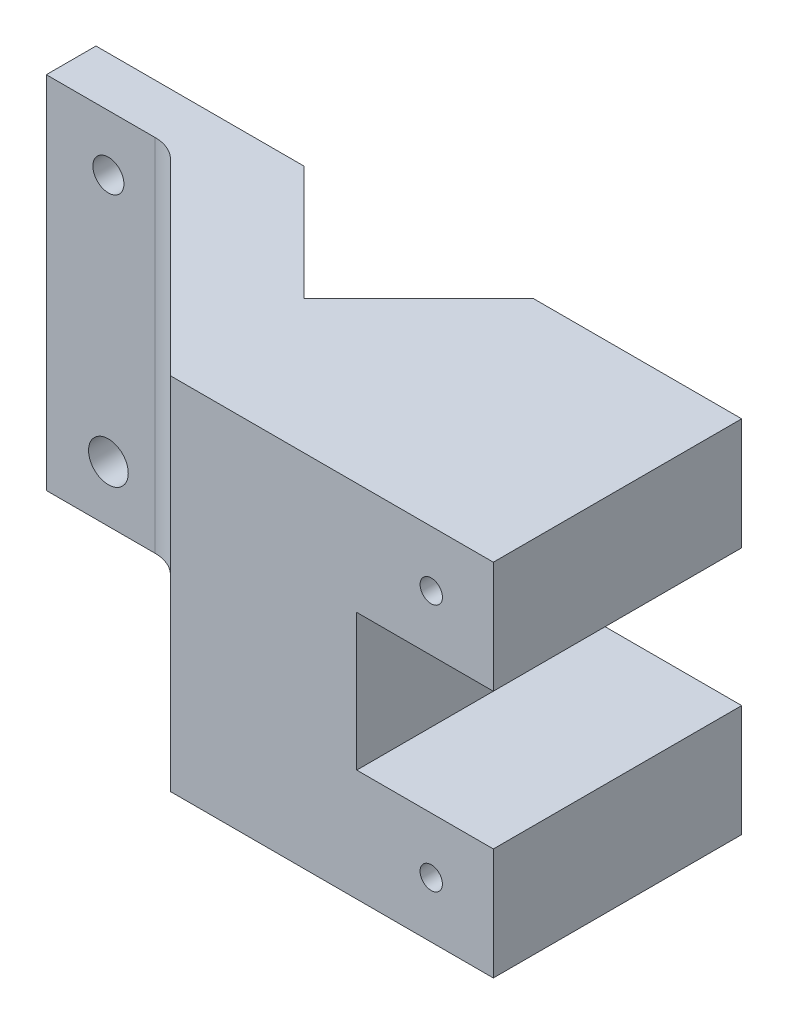
from build123d import *

# Parameters (mm, degrees)
BOSS_EXTRUDE1_DEPTH     = 14.5
CUT_EXTRUDE2_DEPTH      = 36.864327681
CUT_EXTRUDE2_DEPTH_BACK = 36.864327681
SKETCH4_R               = 0.9
SKETCH4_W               = 11
SKETCH4_H               = 11
SKETCH5_R               = 1.25
SKETCH5_R_2             = 1.6
CUT_EXTRUDE3_DEPTH      = 34.797189232
FILLET1_R               = 3
CUT_EXTRUDE5_DEPTH      = 36.864327681
CUT_EXTRUDE5_DEPTH_BACK = 36.864327681


with BuildPart() as part:
    # Sketch1 → Boss-Extrude1 (new, symmetric)
    with BuildSketch(Plane(origin=(0, 0, 0), x_dir=(1, 0, 0), z_dir=(0, 1, 0))):
        Polygon((-7.131727984, 0), (-26, 0), (-26, -4), (-16, -4), (0, -20), (26, -20), (26, 0), (7.131727984, 0), (0, -7.131727984), align=None)
    extrude(amount=BOSS_EXTRUDE1_DEPTH, both=True)

    # Sketch4 → Cut-Extrude2 (cut, two sides: drawn at the far end of the back side and taken through both)
    with BuildSketch(Plane.XY.offset(20).offset(-CUT_EXTRUDE2_DEPTH_BACK)):
        with Locations((21, 10)):
            Circle(SKETCH4_R)
        with Locations((21, -10)):
            Circle(SKETCH4_R)
        with Locations((20.5, 0)):
            Rectangle(SKETCH4_W, SKETCH4_H)
    extrude(amount=CUT_EXTRUDE2_DEPTH + CUT_EXTRUDE2_DEPTH_BACK, mode=Mode.SUBTRACT)

    # Sketch5 → Cut-Extrude3 (cut, through all)
    with BuildSketch(Plane.XY.offset(4)):
        with Locations((-21, 10)):
            Circle(SKETCH5_R)
        with Locations((-21, -10)):
            Circle(SKETCH5_R_2)
    extrude(amount=-CUT_EXTRUDE3_DEPTH, mode=Mode.SUBTRACT)

    # Fillet1
    fillet1_edges = [part.edges().sort_by_distance(p)[0] for p in [
        (-16, 0, 4),
    ]]
    fillet(fillet1_edges, radius=FILLET1_R)

    # Sketch8 → Cut-Extrude5 (cut, two sides: drawn at the far end of the back side and taken through both)
    with BuildSketch(Plane(origin=(0, 0, 0), x_dir=(1, 0, 0), z_dir=(0, 1, 0)).offset(-CUT_EXTRUDE5_DEPTH_BACK)):
        Polygon((9.253048327, 0), (-9.253048327, 0), (0, -9.253048327), align=None)
    extrude(amount=CUT_EXTRUDE5_DEPTH + CUT_EXTRUDE5_DEPTH_BACK, mode=Mode.SUBTRACT)


solid = part.part
